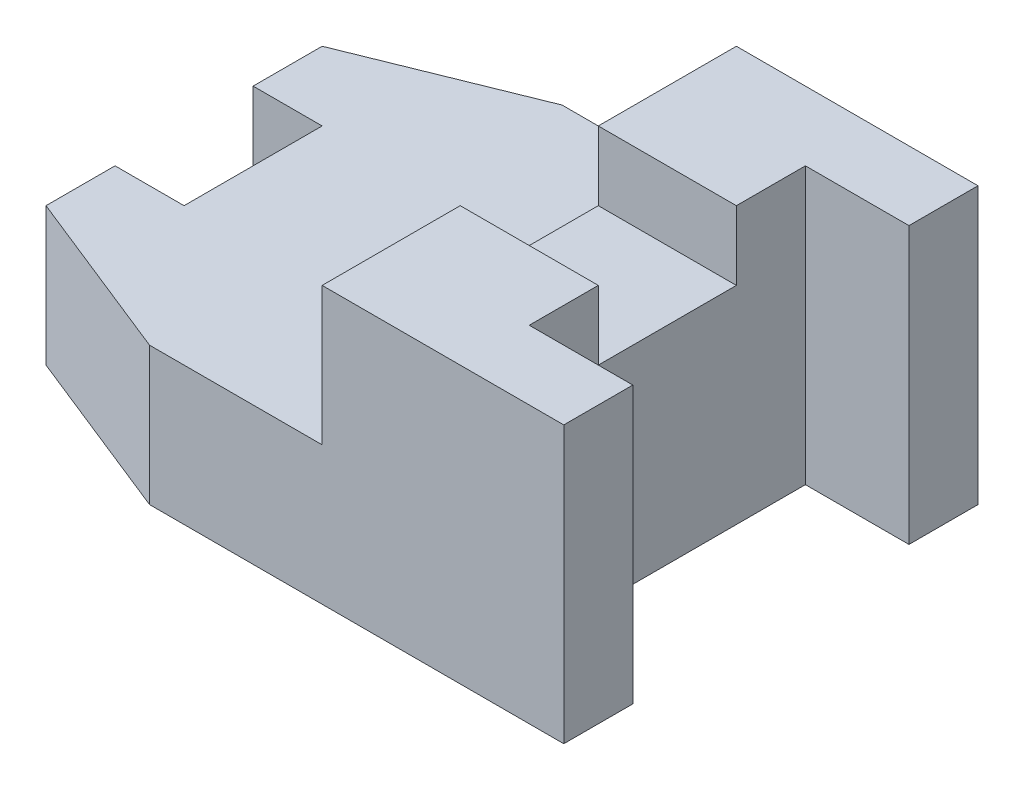
from build123d import *

# Parameters (mm, degrees)
SKETCH1_W               = 85
SKETCH1_H               = 60
BOSS_EXTRUDE1_DEPTH     = 40
SKETCH2_W               = 15
SKETCH2_H               = 40
CUT_EXTRUDE1_DEPTH      = 66.622023742
SKETCH3_W               = 20
SKETCH3_H               = 20
CUT_EXTRUDE2_DEPTH      = 10
CUT_EXTRUDE9_DEPTH      = 66.622023742
CUT_EXTRUDE9_DEPTH_BACK = 20
SKETCH6_W               = 20
SKETCH6_H               = 20
CUT_EXTRUDE10_DEPTH     = 10
CUT_EXTRUDE_THIN5_DEPTH = 56.733742024


with BuildPart() as part:
    # Sketch1 → Boss-Extrude1 (new body)
    with BuildSketch(Plane(origin=(0, 0, 0), x_dir=(1, 0, 0), z_dir=(0, 1, 0))):
        Rectangle(SKETCH1_W, SKETCH1_H)
    extrude(amount=BOSS_EXTRUDE1_DEPTH)

    # Sketch2 → Cut-Extrude1 (cut, through all)
    with BuildSketch(Plane(origin=(0, 40, 0), x_dir=(1, 0, 0), z_dir=(0, 1, 0))):
        with Locations((35, 0)):
            Rectangle(SKETCH2_W, SKETCH2_H)
    extrude(amount=-CUT_EXTRUDE1_DEPTH, mode=Mode.SUBTRACT)

    # Sketch3 → Cut-Extrude2 (cut)
    with BuildSketch(Plane(origin=(0, 40, 0), x_dir=(1, 0, 0), z_dir=(0, 1, 0))):
        with Locations((17.5, 0)):
            Rectangle(SKETCH3_W, SKETCH3_H)
    extrude(amount=-CUT_EXTRUDE2_DEPTH, mode=Mode.SUBTRACT)

    # Sketch4 → Cut-Extrude9 (cut, two sides: drawn at the far end of the back side and taken through both)
    with BuildSketch(Plane(origin=(0, 40, 0), x_dir=(1, 0, 0), z_dir=(0, 1, 0)).offset(-CUT_EXTRUDE9_DEPTH_BACK)):
        Polygon((7.5, 208.497084776), (7.5, 33.386024926), (7.5, -35.691822331), (7.5, -210.802882181), (-342.7221197, -210.802882181), (-342.7221197, 208.497084776), align=None)
    extrude(amount=CUT_EXTRUDE9_DEPTH + CUT_EXTRUDE9_DEPTH_BACK, mode=Mode.SUBTRACT)

    # Sketch6 → Cut-Extrude10 (cut)
    with BuildSketch(Plane.ZY.offset(42.5)):
        with Locations((0, 10)):
            Rectangle(SKETCH6_W, SKETCH6_H)
    extrude(amount=-CUT_EXTRUDE10_DEPTH, mode=Mode.SUBTRACT)

    # Sketch9 → Cut-Extrude-Thin5 (cut, through all)
    with BuildSketch(Plane(origin=(0, 20, 0), x_dir=(1, 0, 0), z_dir=(0, 1, 0))):
        Polygon((-17.5, 30.102443268), (-42.5, 20), (-46.246635858, 29.271608261), (-21.246635858, 39.374051529), align=None)
        Polygon((-42.5, -20), (-17.5, -30), (-21.213906764, -39.284766909), (-46.213906764, -29.284766909), align=None)
    extrude(amount=-CUT_EXTRUDE_THIN5_DEPTH, mode=Mode.SUBTRACT)


solid = part.part
